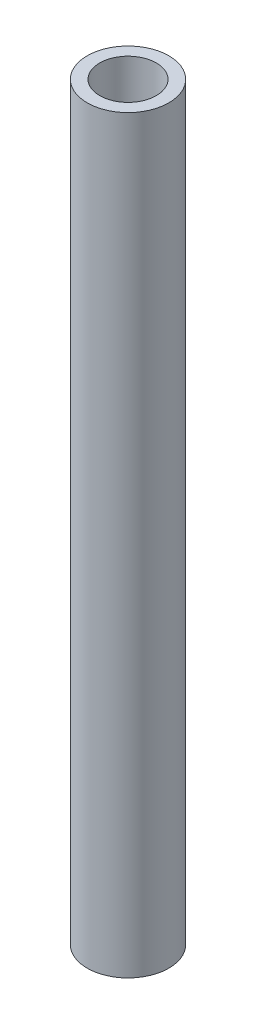
from build123d import *

# Parameters (mm, degrees)
SKETCH1_R           = 16.5989
SKETCH1_R_2         = 11.5189
BOSS_EXTRUDE1_DEPTH = 152.4


with BuildPart() as part:
    # Sketch1 → Boss-Extrude1 (new, symmetric)
    with BuildSketch(Plane(origin=(0, 0, 0), x_dir=(1, 0, 0), z_dir=(0, 1, 0))):
        with Locations(Location((0, 0, 0), (0, 0, 90))):
            Circle(SKETCH1_R)
        with Locations(Location((0, 0, 0), (0, 0, 90))):
            Circle(SKETCH1_R_2, mode=Mode.SUBTRACT)
    extrude(amount=BOSS_EXTRUDE1_DEPTH, both=True)


solid = part.part
